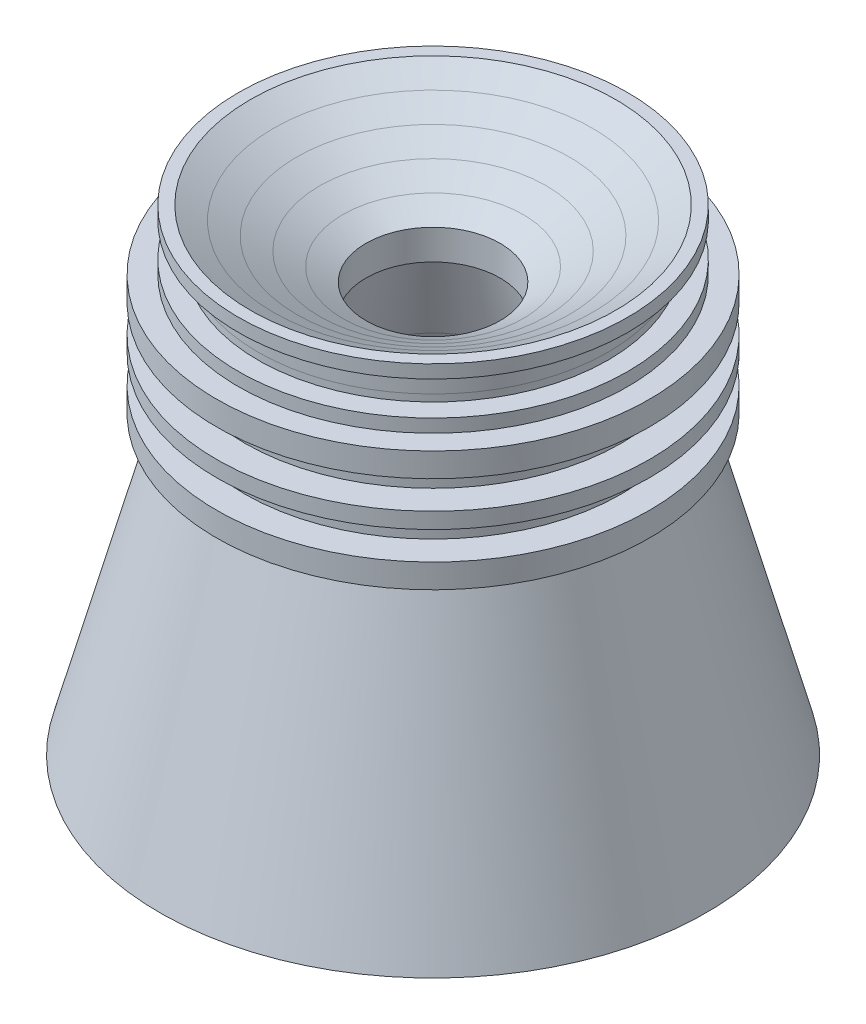
from build123d import *

# Parameters (mm, degrees)
SKETCH2_W   = 4.1529
SKETCH2_H   = 7.1374
SKETCH2_W_2 = 5.941173797
SKETCH2_H_2 = 5.941173796
SKETCH2_H_3 = 5.941173797


with BuildPart() as part:
    # Sketch1 → Revolve1 (revolve)
    with BuildSketch(Plane.XY, mode=Mode.PRIVATE) as revolve1_sk:
        Polygon((41.1353, 50.322953291), (38.5953, 50.322953291), (14.1732, 36.222847282), (14.1732, 29.872847282), (35.6616, -50.322953291), (57.7596, -50.322953291), (41.067887421, 11.97136612), (41.1353, 12.222953291), (45.7327, 12.222953291), (45.7327, 37.622953291), (41.1353, 37.622953291), align=None)
    revolve(revolve1_sk.sketch.rotate(Axis((0, 50.322953291, 0), (0, -1, 0)), 180), axis=Axis((0, 50.322953291, 0), (0, -1, 0)))

    # Sketch2 → Cut-Revolve1 (revolve, cut)
    with BuildSketch(Plane.XY, mode=Mode.PRIVATE) as cut_revolve1_sk:
        with Locations((39.05885, 43.972953291)):
            Rectangle(SKETCH2_W, SKETCH2_H)
        with Locations((42.762113102, 29.572366393)):
            Rectangle(SKETCH2_W_2, SKETCH2_H_2)
        with Locations((42.762113102, 20.27354019)):
            Rectangle(SKETCH2_W_2, SKETCH2_H_3)
    revolve(cut_revolve1_sk.sketch.rotate(Axis((0, 50.322953291, 0), (0, 1, 0)), 180), axis=Axis((0, 50.322953291, 0), (0, 1, 0)), mode=Mode.SUBTRACT)


solid = part.part
